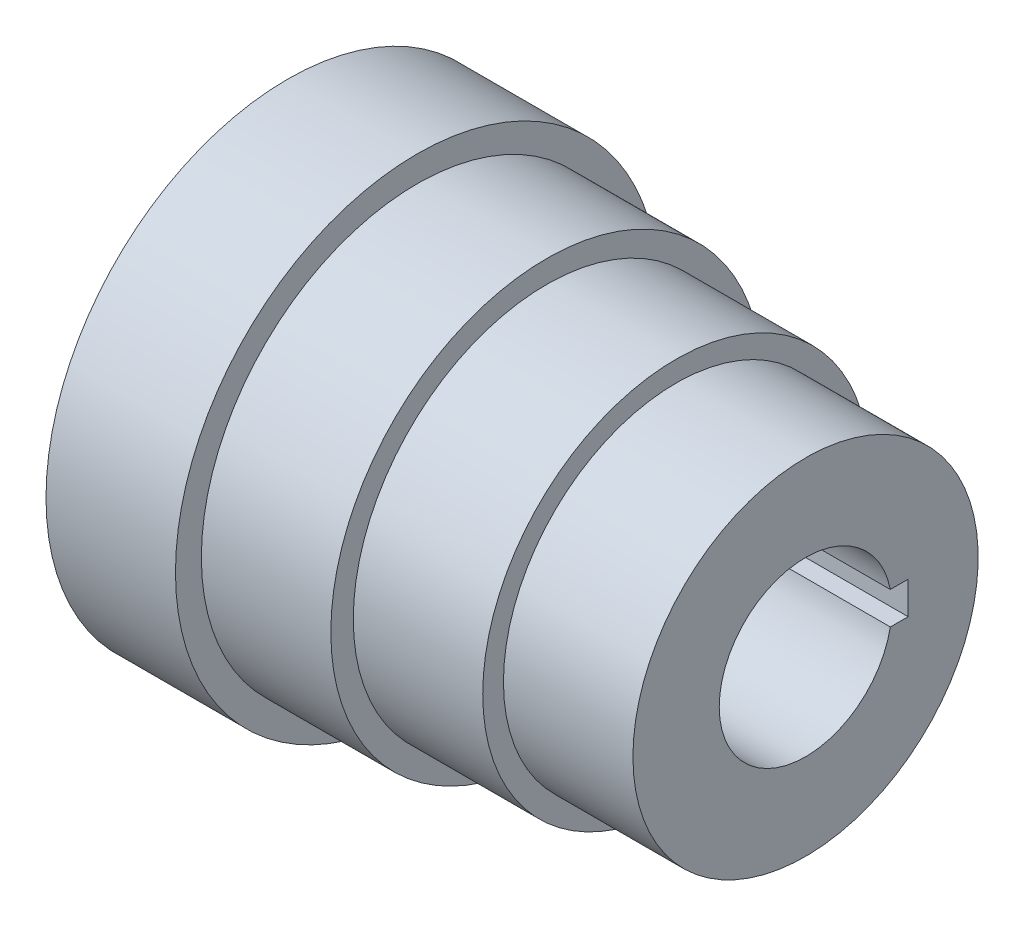
from build123d import *

# Parameters (mm, degrees)
SKETCH3_W          = 4.7752
SKETCH3_H          = 4.7752
CUT_EXTRUDE1_DEPTH = 92.298779839


with BuildPart() as part:
    # Sketch1 → Revolve1 (revolve)
    with BuildSketch(Plane.XY, mode=Mode.PRIVATE) as revolve1_sk:
        with BuildLine():
            Line((-38.1, 35.56), (-19.05, 35.56))
            Line((-19.05, 35.56), (-19.05, 31.75))
            Line((-19.05, 31.75), (0, 31.75))
            Line((0, 31.75), (0, 28.448))
            Line((0, 28.448), (19.05, 28.448))
            Line((19.05, 28.448), (19.05, 25.4))
            Line((19.05, 25.4), (38.1, 25.4))
            Line((38.1, 25.4), (38.1, 12.7))
            Line((38.1, 12.7), (-6.61235224, 12.7))
            ThreePointArc((-6.61235224, 12.7), (-10.239814738, 21.587016556), (-19.05, 25.39728992))
            Line((-19.05, 25.39728992), (-19.096408435, 25.4))
            Line((-19.096408435, 25.4), (-38.1, 25.4))
            Line((-38.1, 25.4), (-38.1, 35.56))
        make_face()
    revolve(revolve1_sk.sketch.rotate(Axis((-38.1, 0, 0), (1, 0, 0)), 90), axis=Axis((-38.1, 0, 0), (1, 0, 0)))

    # Sketch3 → Cut-Extrude1 (cut, through all)
    with BuildSketch(Plane(origin=(38.1, 0, 0), x_dir=(0, 0, -1), z_dir=(1, 0, 0))):
        with Locations((12.7, 0)):
            Rectangle(SKETCH3_W, SKETCH3_H)
    extrude(amount=-CUT_EXTRUDE1_DEPTH, mode=Mode.SUBTRACT)


solid = part.part
